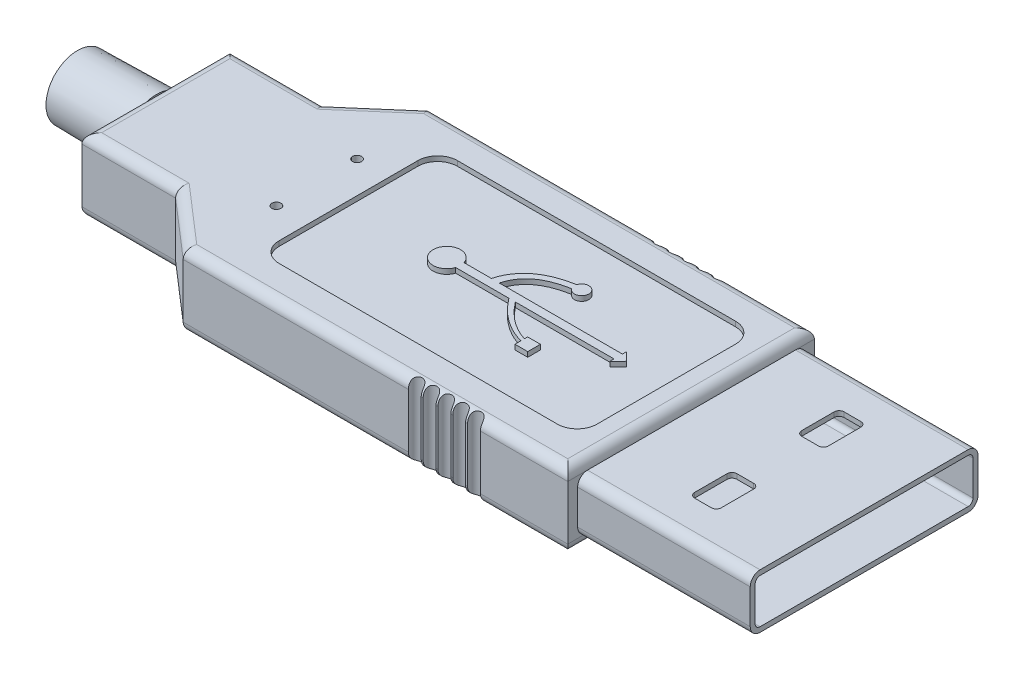
from build123d import *

# Parameters (mm, degrees)
SALIENTE_EXTRUIR1_DEPTH = 7.5
REDONDEO1_R             = 2
EXTRUIR_L_MINA1_DEPTH   = 35
CROQUIS3_R              = 1.314325264
CORTAR_EXTRUIR1_DEPTH   = 80.561681939
CORTAR_EXTRUIR2_DEPTH   = 1
SALIENTE_EXTRUIR2_DEPTH = 1
CROQUIS5_R              = 6.664901932
SALIENTE_EXTRUIR3_DEPTH = 16
SALIENTE_EXTRUIR3_TAPER = 1
CORTAR_EXTRUIR3_DEPTH   = 91.079267712
CROQUIS7_R              = 0.918952067
CORTAR_EXTRUIR4_DEPTH   = 91.389570592


with BuildPart() as part:
    # Croquis1 → Saliente-Extruir1 (new, symmetric)
    with BuildSketch(Plane(origin=(0, 0, 0), x_dir=(1, 0, 0), z_dir=(0, 1, 0))):
        Polygon((38.994752277, 24.90342915), (38.994752277, -25.09657085), (-38.994752277, -25.09657085), (-50.536485845, -15.09657085), (-69.530325489, -15.09657085), (-69.530325489, 14.90342915), (-50.536485845, 14.90342915), (-38.994752277, 24.90342915), align=None)
    extrude(amount=SALIENTE_EXTRUIR1_DEPTH, both=True)

    # Redondeo1
    redondeo1_edges = [part.edges().sort_by_distance(p)[0] for p in [
        (-44.765619061, -7.5, -19.90342915),
        (-60.033405667, -7.5, -14.90342915),
        (-69.530325489, -7.5, 0.09657085),
        (-60.033405667, -7.5, 15.09657085),
        (-44.765619061, -7.5, 20.09657085),
        (0, -7.5, 25.09657085),
        (38.994752277, -7.5, 0.09657085),
        (0, -7.5, -24.90342915),
        (38.994752277, 7.5, 0.09657085),
        (0, 7.5, 25.09657085),
        (-44.765619061, 7.5, 20.09657085),
        (-60.033405667, 7.5, 15.09657085),
        (-69.530325489, 7.5, 0.09657085),
        (-60.033405667, 7.5, -14.90342915),
        (-44.765619061, 7.5, -19.90342915),
        (0, 7.5, -24.90342915),
    ]]
    fillet(redondeo1_edges, radius=REDONDEO1_R)

    # Croquis2 → Extruir-Lámina1 (add)
    with BuildSketch(Plane(origin=(38.994752277, 0, 0), x_dir=(0, 0, -1), z_dir=(1, 0, 0))):
        with BuildLine():
            Line((-23.09657085, 3.5), (-23.09657085, -3.5))
            ThreePointArc((-23.09657085, -3.5), (-22.510784413, -4.914213562), (-21.09657085, -5.5))
            Line((-21.09657085, -5.5), (21.09657085, -5.5))
            ThreePointArc((21.09657085, -5.5), (22.510784413, -4.914213562), (23.09657085, -3.5))
            Line((23.09657085, -3.5), (23.09657085, 3.5))
            ThreePointArc((23.09657085, 3.5), (22.510784413, 4.914213562), (21.09657085, 5.5))
            Line((21.09657085, 5.5), (-21.09657085, 5.5))
            ThreePointArc((-21.09657085, 5.5), (-22.510784413, 4.914213562), (-23.09657085, 3.5))
        make_face()
        with BuildLine():
            Line((-22.09657085, 3.5), (-22.09657085, -3.5))
            ThreePointArc((-22.09657085, -3.5), (-21.803677631, -4.207106781), (-21.09657085, -4.5))
            Line((-21.09657085, -4.5), (21.09657085, -4.5))
            ThreePointArc((21.09657085, -4.5), (21.803677631, -4.207106781), (22.09657085, -3.5))
            Line((22.09657085, -3.5), (22.09657085, 3.5))
            ThreePointArc((22.09657085, 3.5), (21.803677631, 4.207106781), (21.09657085, 4.5))
            Line((21.09657085, 4.5), (-21.09657085, 4.5))
            ThreePointArc((-21.09657085, 4.5), (-21.803677631, 4.207106781), (-22.09657085, 3.5))
        make_face(mode=Mode.SUBTRACT)
    extrude(amount=EXTRUIR_L_MINA1_DEPTH)

    # Croquis3 → Cortar-Extruir1 (cut, through all)
    with BuildSketch(Plane(origin=(0, 7.5, 0), x_dir=(1, 0, 0), z_dir=(0, 1, 0))):
        with Locations((19.973644214, 24.90342915)):
            Circle(CROQUIS3_R)
        with Locations((16.973644214, 24.90342915)):
            Circle(CROQUIS3_R)
        with Locations((13.973644214, 24.90342915)):
            Circle(CROQUIS3_R)
        with Locations((10.973644214, 24.90342915)):
            Circle(CROQUIS3_R)
        with Locations((7.973644214, 24.90342915)):
            Circle(CROQUIS3_R)
        with Locations((7.973644214, -24.90342915)):
            Circle(CROQUIS3_R)
        with Locations((10.973644214, -24.90342915)):
            Circle(CROQUIS3_R)
        with Locations((13.973644214, -24.90342915)):
            Circle(CROQUIS3_R)
        with Locations((16.973644214, -24.90342915)):
            Circle(CROQUIS3_R)
        with Locations((19.973644214, -24.90342915)):
            Circle(CROQUIS3_R)
    extrude(amount=-CORTAR_EXTRUIR1_DEPTH, mode=Mode.SUBTRACT)

    # Croquis3<3> → Cortar-Extruir2 (cut)
    with BuildSketch(Plane(origin=(0, 7.5, 0), x_dir=(1, 0, 0), z_dir=(0, 1, 0))):
        with BuildLine():
            ThreePointArc((-30.565577076, -14.073982948), (-29.3940042, -16.902410073), (-26.565577076, -18.073982948))
            Line((-26.565577076, -18.073982948), (29.88290773, -18.073982948))
            ThreePointArc((29.88290773, -18.073982948), (32.711334855, -16.902410073), (33.88290773, -14.073982948))
            Line((33.88290773, -14.073982948), (33.88290773, 14.073982948))
            ThreePointArc((33.88290773, 14.073982948), (32.711334855, 16.902410073), (29.88290773, 18.073982948))
            Line((29.88290773, 18.073982948), (-26.565577076, 18.073982948))
            ThreePointArc((-26.565577076, 18.073982948), (-29.3940042, 16.902410073), (-30.565577076, 14.073982948))
            Line((-30.565577076, 14.073982948), (-30.565577076, -14.073982948))
        make_face()
    cortar_extruir2 = extrude(amount=-CORTAR_EXTRUIR2_DEPTH, mode=Mode.SUBTRACT)

    # Simetría3: Cortar-Extruir2 across plane
    add(cortar_extruir2.mirror(Plane.ZX), mode=Mode.SUBTRACT)

    # Croquis4 → Saliente-Extruir2 (add)
    with BuildSketch(Plane(origin=(0, 6.5, 0), x_dir=(1, 0, 0), z_dir=(0, 1, 0))):
        with BuildLine():
            Line((24.15885073, -1.721356487), (25.851809177, 0))
            Line((25.851809177, 0), (24.15885073, 1.665028905))
            Line((24.15885073, 1.665028905), (24.15885073, 0.82291726))
            Line((24.15885073, 0.82291726), (-0.809484419, 0.82291726))
            add(Edge.make_bspline(
                [(7.529069805, 7.170811532), (7.295577466, 7.12863814), (6.429873537, 6.956748074), (5.041908052, 6.579510375), (3.514857029, 5.95981001), (2.218806854, 5.206093723), (1.147245072, 4.324238914), (0.28595194, 3.308945627), (-0.373070276, 2.16540632), (-0.690725943, 1.270828935), (-0.809484419, 0.82291726)],
                knots=[0.080522248, 0.080522248, 0.080522248, 0.080522248, 0.125, 0.25, 0.375, 0.5, 0.625, 0.75, 0.875, 1, 1, 1, 1], degree=3))
            ThreePointArc((7.529069805, 7.170811532), (10.187199831, 8.192221902), (7.346554281, 8.391388255))
            add(Edge.make_bspline(
                [(7.346554281, 8.391388255), (7.056415244, 8.340446176), (6.081369536, 8.149505552), (4.52349704, 7.727206713), (2.796321867, 7.028178363), (0.77627782, 5.858018611), (-0.801153151, 4.312535309), (-1.882828086, 2.429051614), (-2.261540051, 1.361645142), (-2.404377368, 0.82291726)],
                knots=[0.074012603, 0.074012603, 0.074012603, 0.074012603, 0.125, 0.25, 0.375, 0.5, 0.75, 0.875, 1, 1, 1, 1], degree=3))
            Line((-2.404377368, 0.82291726), (-7.958796301, 0.82291726))
            ThreePointArc((-7.958796301, 0.82291726), (-13.382333441, -0.028163791), (-7.958796301, -0.879244842))
            Line((-7.958796301, -0.879244842), (2.826698017, -0.879244842))
            add(Edge.make_bspline(
                [(2.826698017, -0.879244842), (3.163184825, -1.322982871), (3.878497133, -2.200070854), (5.348978836, -3.739387356), (7.325465669, -5.336929956), (9.53916535, -6.503301555), (10.985827529, -6.979464517), (11.529288534, -7.122085767)],
                knots=[0, 0, 0, 0, 0.125, 0.25, 0.5, 0.75, 0.896840997, 0.896840997, 0.896840997, 0.896840997], degree=3))
            Line((11.529288534, -7.122085767), (11.529288534, -8.345533865))
            Line((11.529288534, -8.345533865), (14.121018283, -8.345533865))
            Line((14.121018283, -8.345533865), (14.121018283, -5.7706709))
            Line((14.121018283, -5.7706709), (11.529288534, -5.7706709))
            Line((11.529288534, -5.7706709), (11.529288534, -6.405068233))
            add(Edge.make_bspline(
                [(4.141441231, -0.879244842), (4.453402576, -1.290640204), (5.119217222, -2.106932895), (6.466035441, -3.515786557), (8.247234626, -4.952497296), (10.06913855, -5.910914791), (11.195241833, -6.304374634), (11.529288534, -6.405068233)],
                knots=[0, 0, 0, 0, 0.125, 0.25, 0.5, 0.75, 0.853657654, 0.853657654, 0.853657654, 0.853657654], degree=3))
            Line((4.141441231, -0.879244842), (24.15885073, -0.879244842))
            Line((24.15885073, -0.879244842), (24.15885073, -1.721356487))
        make_face()
    extrude(amount=SALIENTE_EXTRUIR2_DEPTH)

    # Croquis5 → Saliente-Extruir3 (add)
    with BuildSketch(Plane.ZY.offset(69.530325489)):
        Circle(CROQUIS5_R)
    extrude(amount=SALIENTE_EXTRUIR3_DEPTH, taper=SALIENTE_EXTRUIR3_TAPER)

    # Croquis6 → Cortar-Extruir3 (cut, through all)
    with BuildSketch(Plane(origin=(0, 5.5, 0), x_dir=(1, 0, 0), z_dir=(0, 1, 0))):
        with BuildLine():
            Line((54.772069532, 15.157328416), (58.173110509, 15.157328416))
            ThreePointArc((58.173110509, 15.157328416), (58.88021729, 14.864435197), (59.173110509, 14.157328416))
            Line((59.173110509, 14.157328416), (59.173110509, 7.564763225))
            ThreePointArc((59.173110509, 7.564763225), (58.88021729, 6.857656443), (58.173110509, 6.564763225))
            Line((58.173110509, 6.564763225), (54.772069532, 6.564763225))
            ThreePointArc((54.772069532, 6.564763225), (54.06496275, 6.857656443), (53.772069532, 7.564763225))
            Line((53.772069532, 7.564763225), (53.772069532, 14.157328416))
            ThreePointArc((53.772069532, 14.157328416), (54.06496275, 14.864435197), (54.772069532, 15.157328416))
        make_face()
        with BuildLine():
            Line((59.173110509, -14.157328416), (59.173110509, -7.564763225))
            ThreePointArc((59.173110509, -7.564763225), (58.88021729, -6.857656443), (58.173110509, -6.564763225))
            Line((58.173110509, -6.564763225), (54.772069532, -6.564763225))
            ThreePointArc((54.772069532, -6.564763225), (54.06496275, -6.857656443), (53.772069532, -7.564763225))
            Line((53.772069532, -7.564763225), (53.772069532, -14.157328416))
            ThreePointArc((53.772069532, -14.157328416), (54.06496275, -14.864435197), (54.772069532, -15.157328416))
            Line((54.772069532, -15.157328416), (58.173110509, -15.157328416))
            ThreePointArc((58.173110509, -15.157328416), (58.88021729, -14.864435197), (59.173110509, -14.157328416))
        make_face()
    extrude(amount=-CORTAR_EXTRUIR3_DEPTH, mode=Mode.SUBTRACT)

    # Croquis7 → Cortar-Extruir4 (cut, through all)
    with BuildSketch(Plane(origin=(0, 7.5, 0), x_dir=(1, 0, 0), z_dir=(0, 1, 0))):
        with Locations((-37.015121785, 8.183435828)):
            Circle(CROQUIS7_R)
        with Locations((-36.97227539, -8.217022918)):
            Circle(CROQUIS7_R)
    extrude(amount=-CORTAR_EXTRUIR4_DEPTH, mode=Mode.SUBTRACT)


solid = part.part
